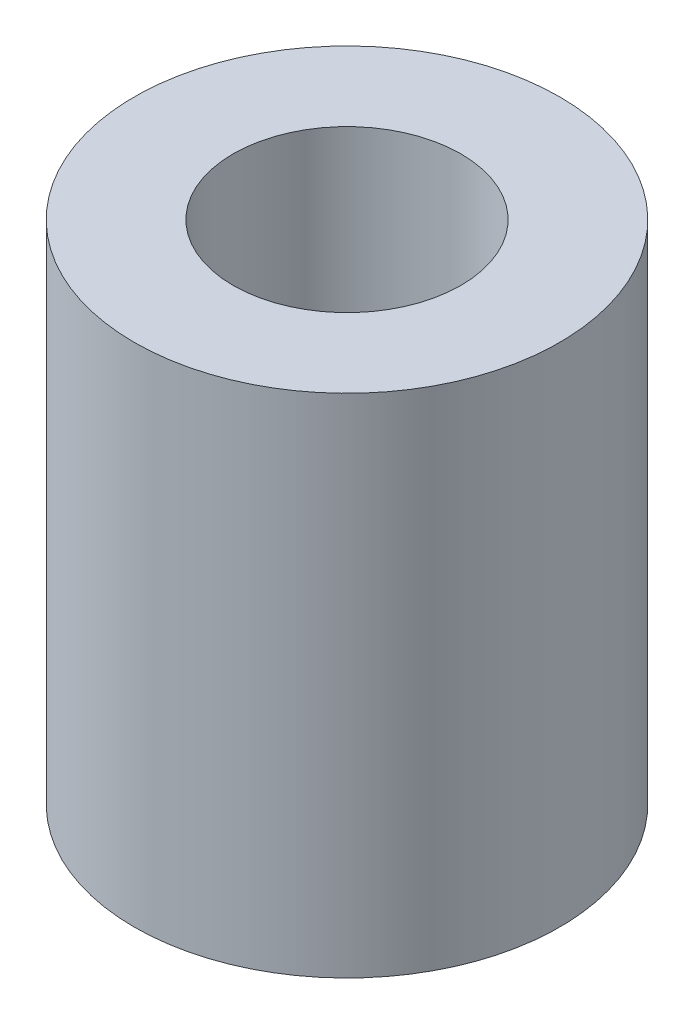
from build123d import *

# Parameters (mm, degrees)
SKETCH1_R           = 4.2
SKETCH1_R_2         = 2.25
BOSS_EXTRUDE1_DEPTH = 10


with BuildPart() as part:
    # Sketch1 → Boss-Extrude1 (new body)
    with BuildSketch(Plane(origin=(0, 0, 0), x_dir=(1, 0, 0), z_dir=(0, 1, 0))):
        with Locations(Location((0, 0, 0), (0, 0, 270))):
            Circle(SKETCH1_R)
        with Locations(Location((0, 0, 0), (0, 0, 270))):
            Circle(SKETCH1_R_2, mode=Mode.SUBTRACT)
    extrude(amount=BOSS_EXTRUDE1_DEPTH)


solid = part.part
